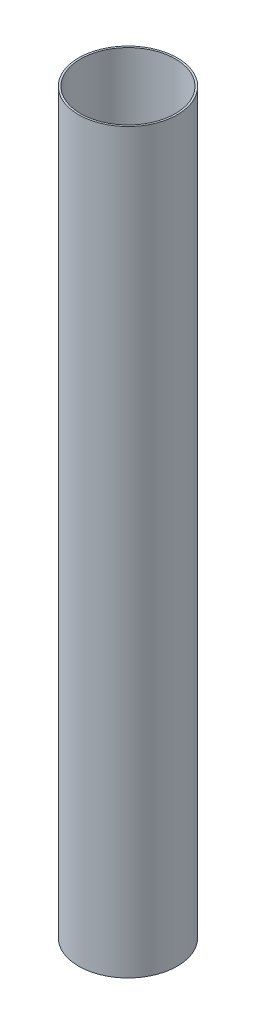
from build123d import *

# Parameters (mm, degrees)
SKETCH1_R           = 39.624
SKETCH1_R_2         = 38.1
BOSS_EXTRUDE1_DEPTH = 592.36


with BuildPart() as part:
    # Sketch1 → Boss-Extrude1 (new body)
    with BuildSketch(Plane(origin=(0, 0, 0), x_dir=(1, 0, 0), z_dir=(0, 1, 0))):
        with Locations(Location((0, 0, 0), (0, 0, 270))):
            Circle(SKETCH1_R)
        with Locations(Location((0, 0, 0), (0, 0, 270))):
            Circle(SKETCH1_R_2, mode=Mode.SUBTRACT)
    extrude(amount=BOSS_EXTRUDE1_DEPTH)


solid = part.part
